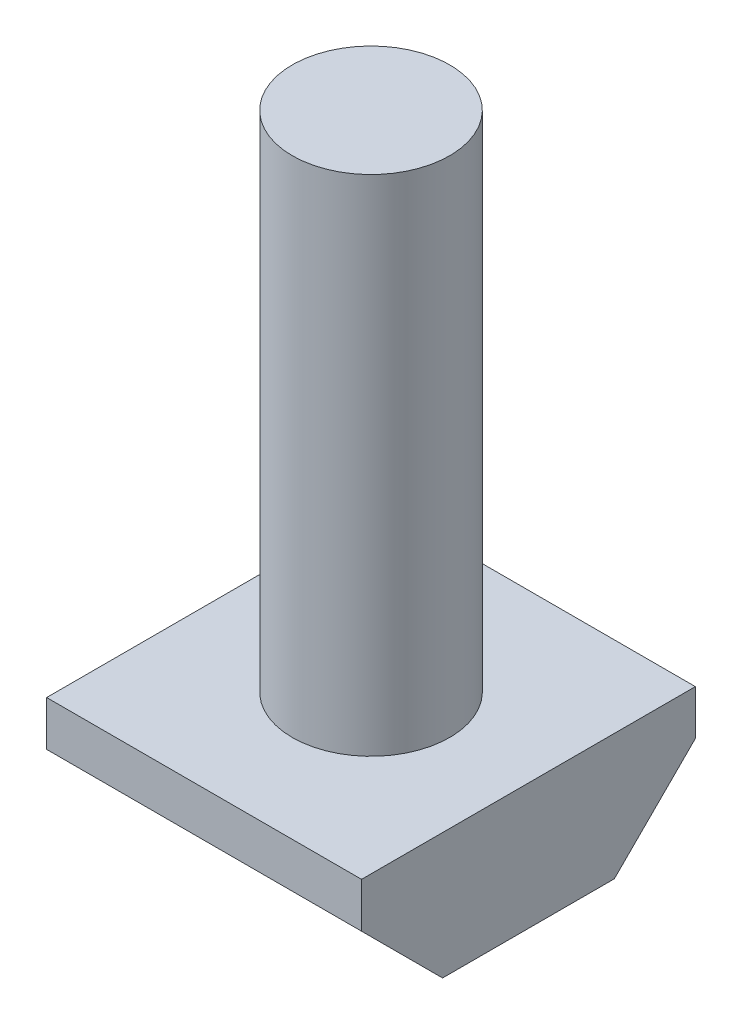
from build123d import *

# Parameters (mm, degrees)
BOSS_EXTRUDE1_DEPTH = 10
BOSS_EXTRUDE2_DEPTH = 16


with BuildPart() as part:
    # Sketch1 → Boss-Extrude1 (new body)
    with BuildSketch(Plane(origin=(0, 0, 0), x_dir=(0, 0, -1), z_dir=(1, 0, 0))):
        Polygon((-19.511221689, 9.49340082), (-14.056806101, 9.49340082), (-11.484013895, 12.066193026), (-11.484013895, 13.49340082), (-13.684013895, 13.49340082), (-19.884013895, 13.49340082), (-22.084013895, 13.49340082), (-22.084013895, 12.066193026), align=None)
    extrude(amount=BOSS_EXTRUDE1_DEPTH)

    # Sketch2 → Boss-Extrude2 (add)
    with BuildSketch(Plane(origin=(0, 13.49340082, 0), x_dir=(1, 0, 0), z_dir=(0, 1, 0))):
        with BuildLine():
            ThreePointArc((7.5, -16.784013895), (6.767766953, -15.016246942), (5, -14.284013895))
            Line((5, -14.284013895), (5, -16.784013895))
            Line((5, -16.784013895), (7.5, -16.784013895))
        make_face()
        with BuildLine():
            Line((5, -16.784013895), (5, -14.284013895))
            ThreePointArc((5, -14.284013895), (3.232233047, -15.016246942), (2.5, -16.784013895))
            Line((2.5, -16.784013895), (5, -16.784013895))
        make_face()
        with BuildLine():
            Line((7.5, -16.784013895), (5, -16.784013895))
            Line((5, -16.784013895), (5, -19.284013895))
            ThreePointArc((5, -19.284013895), (6.767766953, -18.551780848), (7.5, -16.784013895))
        make_face()
        with BuildLine():
            Line((5, -19.284013895), (5, -16.784013895))
            Line((5, -16.784013895), (2.5, -16.784013895))
            ThreePointArc((2.5, -16.784013895), (3.232233047, -18.551780848), (5, -19.284013895))
        make_face()
    extrude(amount=BOSS_EXTRUDE2_DEPTH)


solid = part.part
